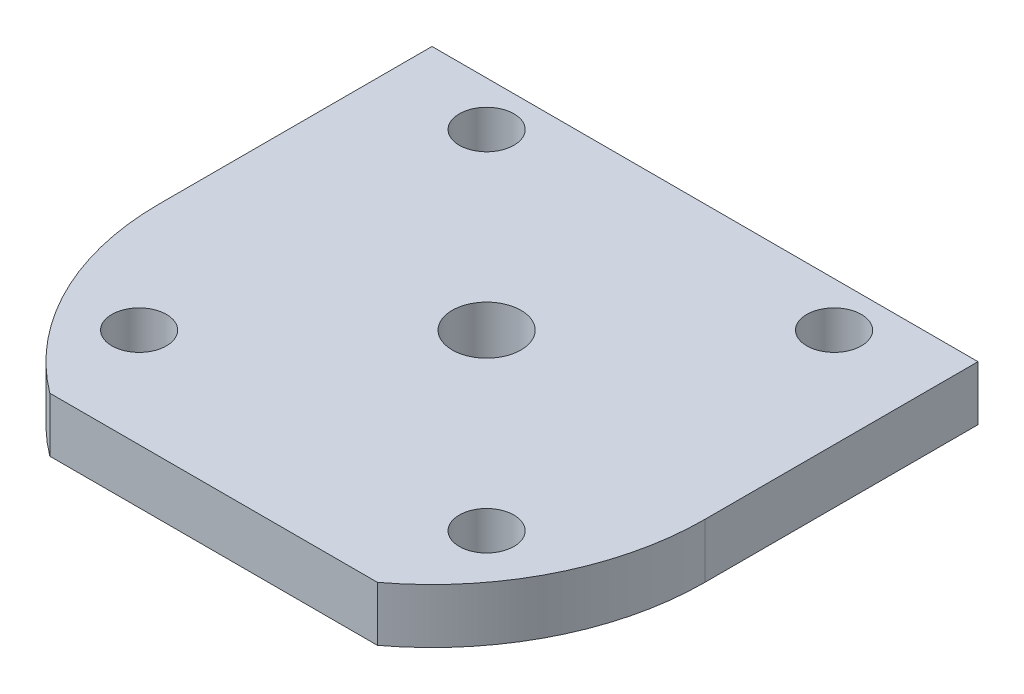
from build123d import *

# Parameters (mm, degrees)
SKETCH1_R           = 3.175
SKETCH1_R_2         = 4
BOSS_EXTRUDE1_DEPTH = 6.35


with BuildPart() as part:
    # Sketch1 → Boss-Extrude1 (new body)
    with BuildSketch(Plane(origin=(0, 0, 0), x_dir=(1, 0, 0), z_dir=(0, 1, 0))):
        with BuildLine():
            Line((-31.75, 25.4), (-31.75, 0))
            Line((-31.75, 0), (-31.75, -6.35))
            ThreePointArc((-31.75, -6.35), (-28.398063314, -20.549031657), (-19.05, -31.75))
            Line((-19.05, -31.75), (19.05, -31.75))
            ThreePointArc((19.05, -31.75), (28.398063314, -20.549031657), (31.75, -6.35))
            Line((31.75, -6.35), (31.75, 0))
            Line((31.75, 0), (31.75, 25.4))
            Line((31.75, 25.4), (-31.75, 25.4))
        make_face()
        with Locations((-20.205576272, -20.205576272)):
            Circle(SKETCH1_R, mode=Mode.SUBTRACT)
        with Locations((20.205576272, -20.205576272)):
            Circle(SKETCH1_R, mode=Mode.SUBTRACT)
        Circle(SKETCH1_R_2, mode=Mode.SUBTRACT)
        with Locations((-20.205576272, 20.205576272)):
            Circle(SKETCH1_R, mode=Mode.SUBTRACT)
        with Locations((20.205576272, 20.205576272)):
            Circle(SKETCH1_R, mode=Mode.SUBTRACT)
    extrude(amount=BOSS_EXTRUDE1_DEPTH)


solid = part.part
